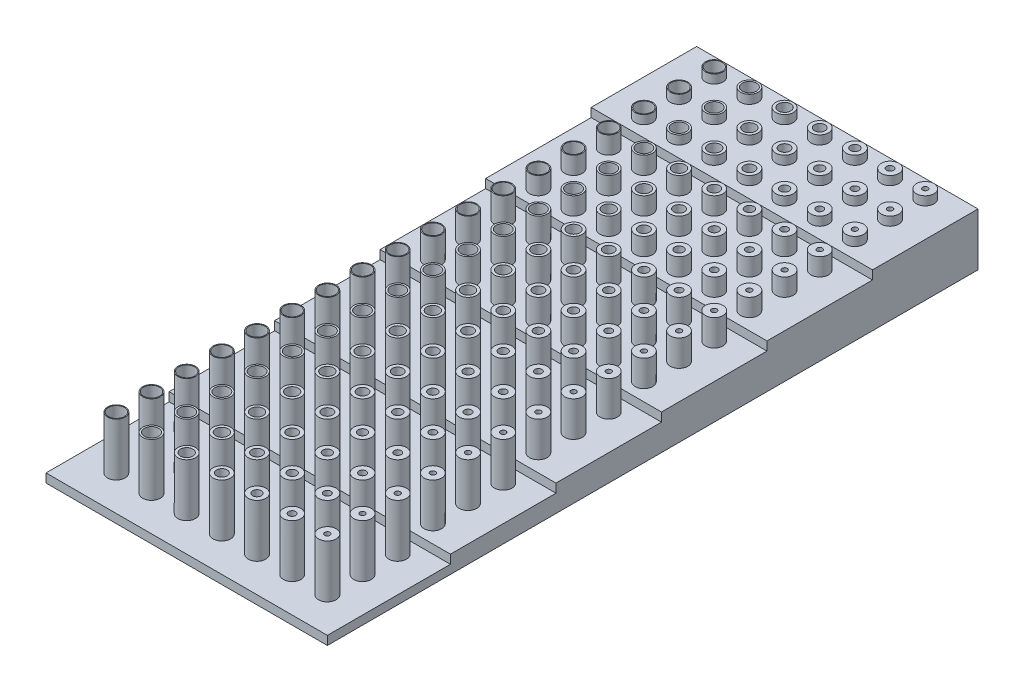
from build123d import *

# Parameters (mm, degrees)
SKETCH1_W           = 16
SKETCH1_H           = 37
BOSS_EXTRUDE1_DEPTH = 0.5
SKETCH3_R           = 0.5
SKETCH3_R_2         = 0.45
EXTRUDE_THIN1_DEPTH = 3.5
SKETCH4_R           = 0.5
SKETCH4_R_2         = 0.4
EXTRUDE_THIN2_DEPTH = 3
SKETCH5_R           = 0.5
SKETCH5_R_2         = 0.35
EXTRUDE_THIN3_DEPTH = 3
SKETCH6_R           = 0.5
SKETCH6_R_2         = 0.3
EXTRUDE_THIN4_DEPTH = 3
SKETCH7_R           = 0.5
SKETCH7_R_2         = 0.25
EXTRUDE_THIN5_DEPTH = 3
SKETCH8_R           = 0.5
SKETCH8_R_2         = 0.2
EXTRUDE_THIN6_DEPTH = 3
SKETCH9_R           = 0.5
SKETCH9_R_2         = 0.15
EXTRUDE_THIN7_DEPTH = 3
SKETCH12_R          = 0.15
SKETCH12_R_2        = 0.2
SKETCH12_R_3        = 0.25
SKETCH12_R_4        = 0.3
SKETCH12_R_5        = 0.35
SKETCH12_R_6        = 0.4
SKETCH12_R_7        = 0.45
CUT_EXTRUDE1_DEPTH  = 41.422765863
BOSS_EXTRUDE2_DEPTH = 16
LPATTERN1_COUNT     = 18
LPATTERN1_PITCH     = 2


with BuildPart() as part:
    # Sketch1 → Boss-Extrude1 (new body)
    with BuildSketch(Plane(origin=(0, 0, 0), x_dir=(1, 0, 0), z_dir=(0, 1, 0))):
        with Locations((8, 18.5)):
            Rectangle(SKETCH1_W, SKETCH1_H)
    extrude(amount=BOSS_EXTRUDE1_DEPTH)

    # Sketch3 → Extrude-Thin1 (add)
    with BuildSketch(Plane(origin=(0, 0, 0), x_dir=(1, 0, 0), z_dir=(0, 1, 0))):
        with Locations((2, 2)):
            Circle(SKETCH3_R)
        with Locations((2, 2)):
            Circle(SKETCH3_R_2, mode=Mode.SUBTRACT)
    extrude_thin1 = extrude(amount=EXTRUDE_THIN1_DEPTH)

    # Sketch4 → Extrude-Thin2 (add)
    with BuildSketch(Plane(origin=(0, 0.5, 0), x_dir=(1, 0, 0), z_dir=(0, 1, 0))):
        with Locations((4, 2)):
            Circle(SKETCH4_R)
        with Locations((4, 2)):
            Circle(SKETCH4_R_2, mode=Mode.SUBTRACT)
    extrude_thin2 = extrude(amount=EXTRUDE_THIN2_DEPTH)

    # Sketch5 → Extrude-Thin3 (add)
    with BuildSketch(Plane(origin=(0, 0.5, 0), x_dir=(1, 0, 0), z_dir=(0, 1, 0))):
        with Locations((6, 2)):
            Circle(SKETCH5_R)
        with Locations((6, 2)):
            Circle(SKETCH5_R_2, mode=Mode.SUBTRACT)
    extrude_thin3 = extrude(amount=EXTRUDE_THIN3_DEPTH)

    # Sketch6 → Extrude-Thin4 (add)
    with BuildSketch(Plane(origin=(0, 0.5, 0), x_dir=(1, 0, 0), z_dir=(0, 1, 0))):
        with Locations((8, 2)):
            Circle(SKETCH6_R)
        with Locations((8, 2)):
            Circle(SKETCH6_R_2, mode=Mode.SUBTRACT)
    extrude_thin4 = extrude(amount=EXTRUDE_THIN4_DEPTH)

    # Sketch7 → Extrude-Thin5 (add)
    with BuildSketch(Plane(origin=(0, 0.5, 0), x_dir=(1, 0, 0), z_dir=(0, 1, 0))):
        with Locations((10, 2)):
            Circle(SKETCH7_R)
        with Locations((10, 2)):
            Circle(SKETCH7_R_2, mode=Mode.SUBTRACT)
    extrude_thin5 = extrude(amount=EXTRUDE_THIN5_DEPTH)

    # Sketch8 → Extrude-Thin6 (add)
    with BuildSketch(Plane(origin=(0, 0.5, 0), x_dir=(1, 0, 0), z_dir=(0, 1, 0))):
        with Locations((12, 2)):
            Circle(SKETCH8_R)
        with Locations((12, 2)):
            Circle(SKETCH8_R_2, mode=Mode.SUBTRACT)
    extrude_thin6 = extrude(amount=EXTRUDE_THIN6_DEPTH)

    # Sketch9 → Extrude-Thin7 (add)
    with BuildSketch(Plane(origin=(0, 0.5, 0), x_dir=(1, 0, 0), z_dir=(0, 1, 0))):
        with Locations((14, 2)):
            Circle(SKETCH9_R)
        with Locations((14, 2)):
            Circle(SKETCH9_R_2, mode=Mode.SUBTRACT)
    extrude_thin7 = extrude(amount=EXTRUDE_THIN7_DEPTH)

    # Sketch12 → Cut-Extrude1 (cut, symmetric)
    with BuildSketch(Plane(origin=(0, 0.5, 0), x_dir=(1, 0, 0), z_dir=(0, 1, 0))):
        with Locations((14, 2)):
            Circle(SKETCH12_R)
        with Locations((12, 2)):
            Circle(SKETCH12_R_2)
        with Locations((10, 2)):
            Circle(SKETCH12_R_3)
        with Locations((8, 2)):
            Circle(SKETCH12_R_4)
        with Locations((6, 2)):
            Circle(SKETCH12_R_5)
        with Locations((4, 2)):
            Circle(SKETCH12_R_6)
        with Locations((2, 2)):
            Circle(SKETCH12_R_7)
    cut_extrude1 = extrude(amount=CUT_EXTRUDE1_DEPTH, both=True, mode=Mode.SUBTRACT)

    # Sketch10 → Boss-Extrude2 (add)
    with BuildSketch(Plane.ZY):
        Polygon((-7, 0.5), (-7, 1), (-13, 1), (-13, 1.5), (-19, 1.5), (-19, 2), (-25, 2), (-25, 2.5), (-31, 2.5), (-31, 3), (-37, 3), (-37, 0.5), align=None)
    extrude(amount=-BOSS_EXTRUDE2_DEPTH)

    # LPattern1: Extrude-Thin1, Extrude-Thin2, Extrude-Thin3, Extrude-Thin4, Extrude-Thin5, Extrude-Thin6, Extrude-Thin7, Cut-Extrude1 ×18
    with Locations(*[(0, 0, -i * LPATTERN1_PITCH) for i in range(1, LPATTERN1_COUNT)]):
        add(extrude_thin1)
        add(extrude_thin2)
        add(extrude_thin3)
        add(extrude_thin4)
        add(extrude_thin5)
        add(extrude_thin6)
        add(extrude_thin7)
        add(cut_extrude1, mode=Mode.SUBTRACT)


solid = part.part
